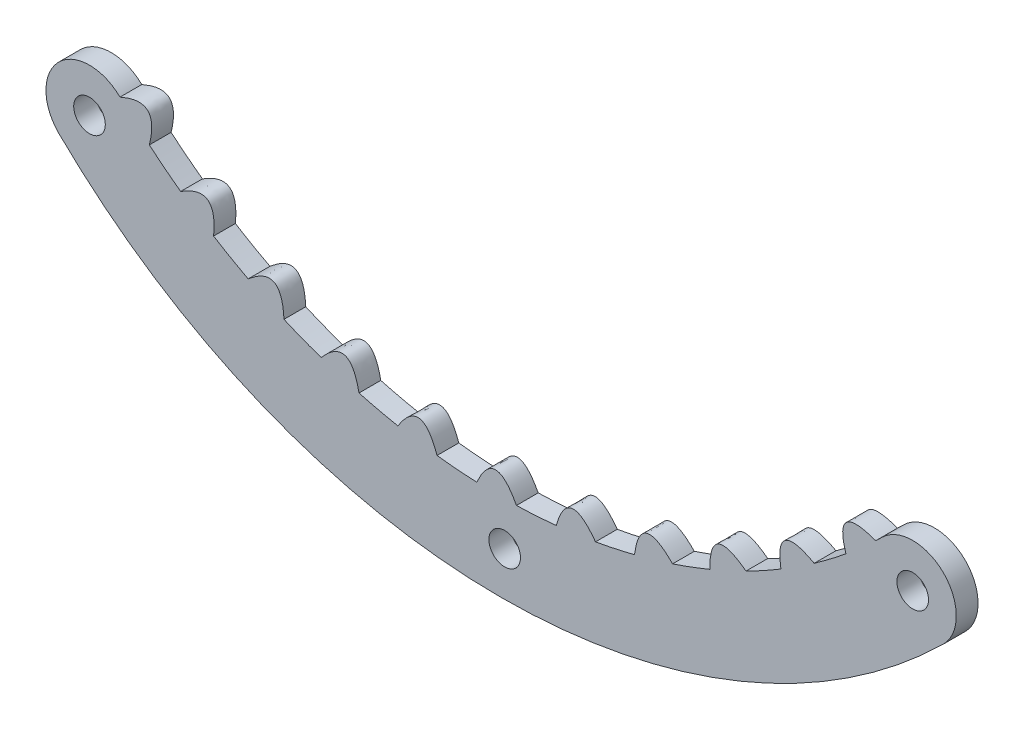
from build123d import *

# Parameters (mm, degrees)
EXTRUDE_1_DEPTH     = 2
EXTRUDE_START       = -2
EXTRUDE_6_DEPTH     = 2
SKETCH_3_R          = 1.45
CUT_EXTRUDE_1_DEPTH = 2


with BuildPart() as part:
    # 草图1 → 凸台-拉伸1 (new body)
    with BuildSketch(Plane.XY):
        with BuildLine():
            ThreePointArc((34.999399669, -35.707730574), (0, -50), (-34.999399669, -35.707730574))
            ThreePointArc((-34.999399669, -35.707730574), (-40.655970089, -35.764397047), (-40.599303617, -41.420967466))
            ThreePointArc((-40.599303617, -41.420967466), (0, -58), (40.599303617, -41.420967466))
            ThreePointArc((40.599303617, -41.420967466), (40.655970089, -35.764397047), (34.999399669, -35.707730574))
        make_face()
    extrude(amount=EXTRUDE_1_DEPTH)

    # 草图2 → 凸台-拉伸6 (add)
    with BuildSketch(Plane.XY.offset(2).offset(EXTRUDE_START)):
        with BuildLine():
            add(Edge.make_bspline(
                [(-34.999399669, -35.707730574), (-31.293036679, -34.051470167), (-32.304776642, -38.162827543)],
                knots=[0, 0, 0, 1, 1, 1], degree=2))
            ThreePointArc((-34.999399669, -35.707730574), (-33.674469744, -36.959844257), (-32.304776642, -38.162827543))
        make_face()
        with BuildLine():
            add(Edge.make_bspline(
                [(-29.427336681, -40.423159895), (-26.001624486, -38.244898865), (-26.403964274, -42.459753539)],
                knots=[0, 0, 0, 1, 1, 1], degree=2))
            ThreePointArc((-29.427336681, -40.423159895), (-27.934216832, -41.469018918), (-26.403964274, -42.459753539))
        make_face()
        with BuildLine():
            add(Edge.make_bspline(
                [(-23.228081101, -44.277039743), (-20.15603281, -41.623203943), (-19.940397248, -45.851723605)],
                knots=[0, 0, 0, 1, 1, 1], degree=2))
            ThreePointArc((-23.228081101, -44.277039743), (-21.598594585, -45.094353437), (-19.940397248, -45.851723605))
        make_face()
        with BuildLine():
            add(Edge.make_bspline(
                [(-16.5337593, -47.18723136), (-13.880850288, -44.114382693), (-13.051835275, -48.266443788)],
                knots=[0, 0, 0, 1, 1, 1], degree=2))
            ThreePointArc((-16.5337593, -47.18723136), (-14.802635794, -47.758580104), (-13.051835275, -48.266443788))
        make_face()
        with BuildLine():
            add(Edge.make_bspline(
                [(-9.487049125, -49.091709065), (-7.309821542, -45.665339966), (-5.885096092, -49.65244852)],
                knots=[0, 0, 0, 1, 1, 1], degree=2))
            ThreePointArc((-9.487049125, -49.091709065), (-7.69118452, -49.404915552), (-5.885096092, -49.65244852))
        make_face()
        with BuildLine():
            add(Edge.make_bspline(
                [(-2.238138968, -49.949882222), (-0.58299664, -46.243019798), (1.407073696, -49.980197515)],
                knots=[0, 0, 0, 1, 1, 1], degree=2))
            ThreePointArc((-2.238138968, -49.949882222), (-0.415809002, -49.998270999), (1.407073696, -49.980197515))
        make_face()
        with BuildLine():
            add(Edge.make_bspline(
                [(5.058473235, -49.743460359), (6.156253823, -45.835109949), (8.669254151, -49.242705373)],
                knots=[0, 0, 0, 1, 1, 1], degree=2))
            ThreePointArc((5.058473235, -49.743460359), (6.868428764, -49.526000104), (8.669254151, -49.242705373))
        make_face()
        with BuildLine():
            add(Edge.make_bspline(
                [(31.66559238, -38.694835046), (30.424637319, -34.829559417), (34.400675338, -36.284894051)],
                knots=[0, 0, 0, 1, 1, 1], degree=2))
            ThreePointArc((31.66559238, -38.694835046), (33.055103788, -37.514798594), (34.400675338, -36.284894051))
        make_face()
        with BuildLine():
            add(Edge.make_bspline(
                [(25.69413065, -42.893025659), (25.029188635, -38.888256343), (28.750957058, -40.906997791)],
                knots=[0, 0, 0, 1, 1, 1], degree=2))
            ThreePointArc((25.69413065, -42.893025659), (27.240649231, -41.927878905), (28.750957058, -40.906997791))
        make_face()
        with BuildLine():
            add(Edge.make_bspline(
                [(19.175043133, -46.177025899), (19.100286249, -42.118117602), (22.488462044, -44.657239893)],
                knots=[0, 0, 0, 1, 1, 1], degree=2))
            ThreePointArc((19.175043133, -46.177025899), (20.84560753, -45.44733927), (22.488462044, -44.657239893))
        make_face()
        with BuildLine():
            add(Edge.make_bspline(
                [(12.247272863, -48.476843002), (12.764294423, -44.450304307), (15.746664505, -47.455690459)],
                knots=[0, 0, 0, 1, 1, 1], degree=2))
            ThreePointArc((12.247272863, -48.476843002), (14.006277895, -47.998168502), (15.746664505, -47.455690459))
        make_face()
    extrude(amount=EXTRUDE_6_DEPTH)

    # 草图3 → 切除-拉伸1 (cut)
    with BuildSketch(Plane.XY.offset(2)):
        with Locations((-37.799351643, -38.56434902)):
            Circle(SKETCH_3_R)
        with Locations((0.328913231, -53.956500006)):
            Circle(SKETCH_3_R)
        with Locations((37.799351643, -38.56434902)):
            Circle(SKETCH_3_R)
    extrude(amount=-CUT_EXTRUDE_1_DEPTH, mode=Mode.SUBTRACT)


solid = part.part
